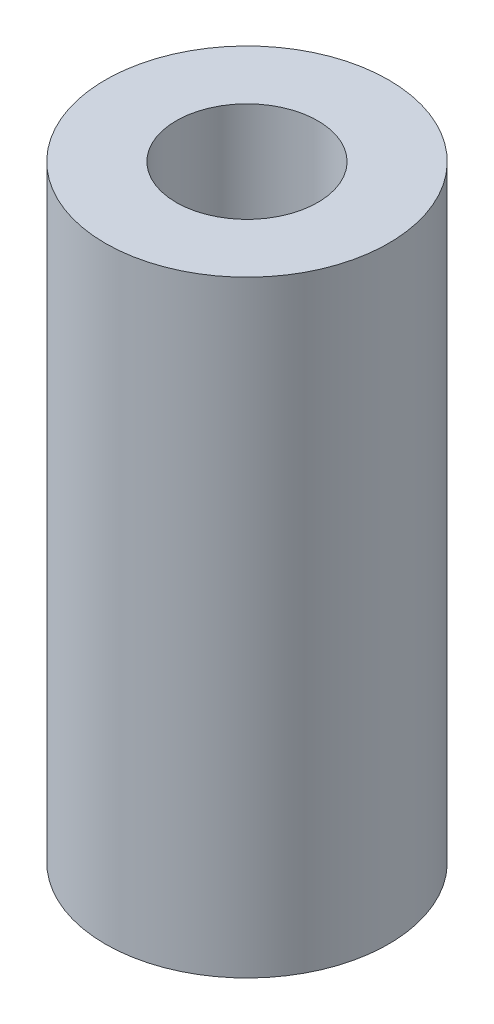
from build123d import *

# Parameters (mm, degrees)
SKETCH1_R           = 3.5
SKETCH1_R_2         = 1.75
BOSS_EXTRUDE1_DEPTH = 15


with BuildPart() as part:
    # Sketch1 → Boss-Extrude1 (new body)
    with BuildSketch(Plane(origin=(0, 0, 0), x_dir=(1, 0, 0), z_dir=(0, 1, 0))):
        with Locations(Location((0, 0, 0), (0, 0, 270))):
            Circle(SKETCH1_R)
        with Locations(Location((0, 0, 0), (0, 0, 270))):
            Circle(SKETCH1_R_2, mode=Mode.SUBTRACT)
    extrude(amount=BOSS_EXTRUDE1_DEPTH)


solid = part.part
